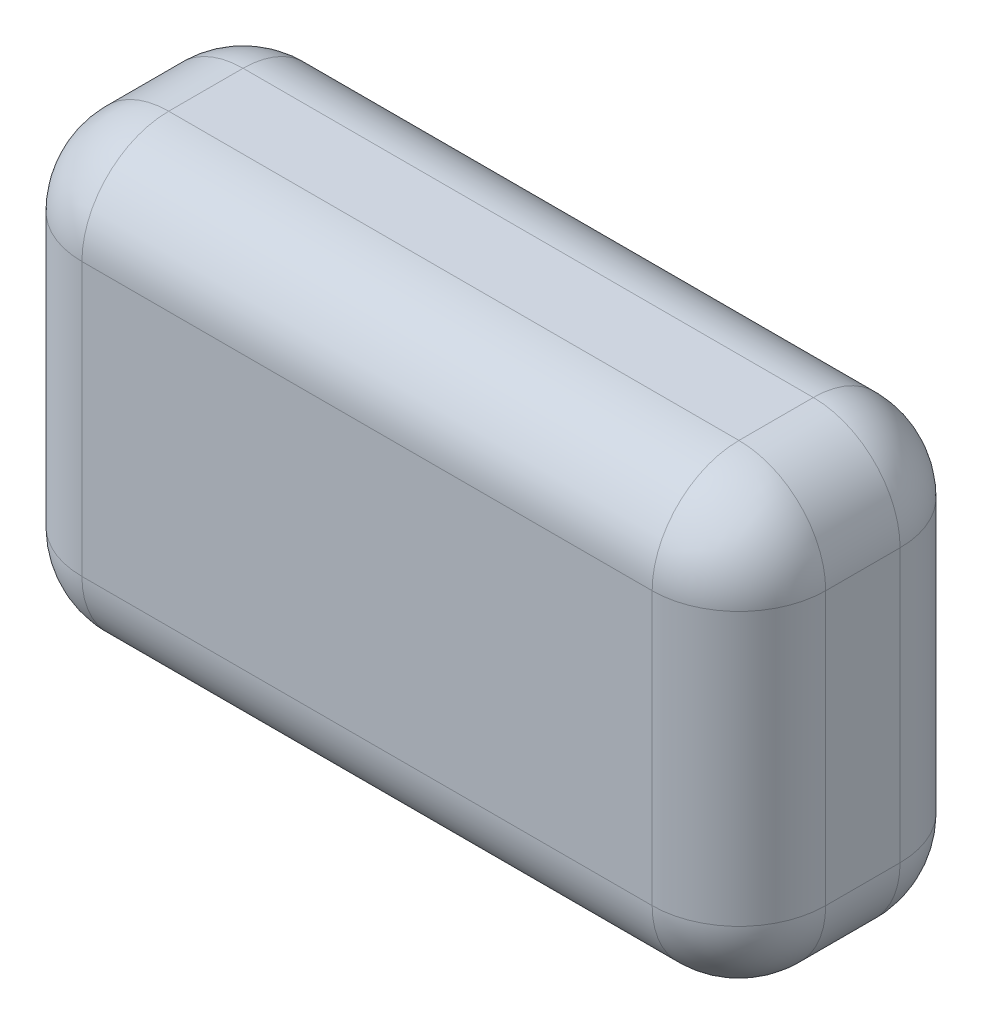
from build123d import *

# Parameters (mm, degrees)
SKETCH1_W           = 762
SKETCH1_H           = 457.2
BOSS_EXTRUDE1_DEPTH = 127
FILLET1_R           = 88.9


with BuildPart() as part:
    # Sketch1 → Boss-Extrude1 (new, symmetric)
    with BuildSketch(Plane.XY):
        Rectangle(SKETCH1_W, SKETCH1_H)
    extrude(amount=BOSS_EXTRUDE1_DEPTH, both=True)

    # Fillet1
    fillet1_edges = [part.edges().sort_by_distance(p)[0] for p in [
        (-381, 0, 127),
        (0, -228.6, 127),
        (381, 0, 127),
        (0, -228.6, -127),
        (-381, 0, -127),
        (0, 228.6, -127),
        (381, 0, -127),
        (381, -228.6, 0),
        (-381, -228.6, 0),
        (-381, 228.6, 0),
        (381, 228.6, 0),
        (0, 228.6, 127),
    ]]
    fillet(fillet1_edges, radius=FILLET1_R)


solid = part.part
